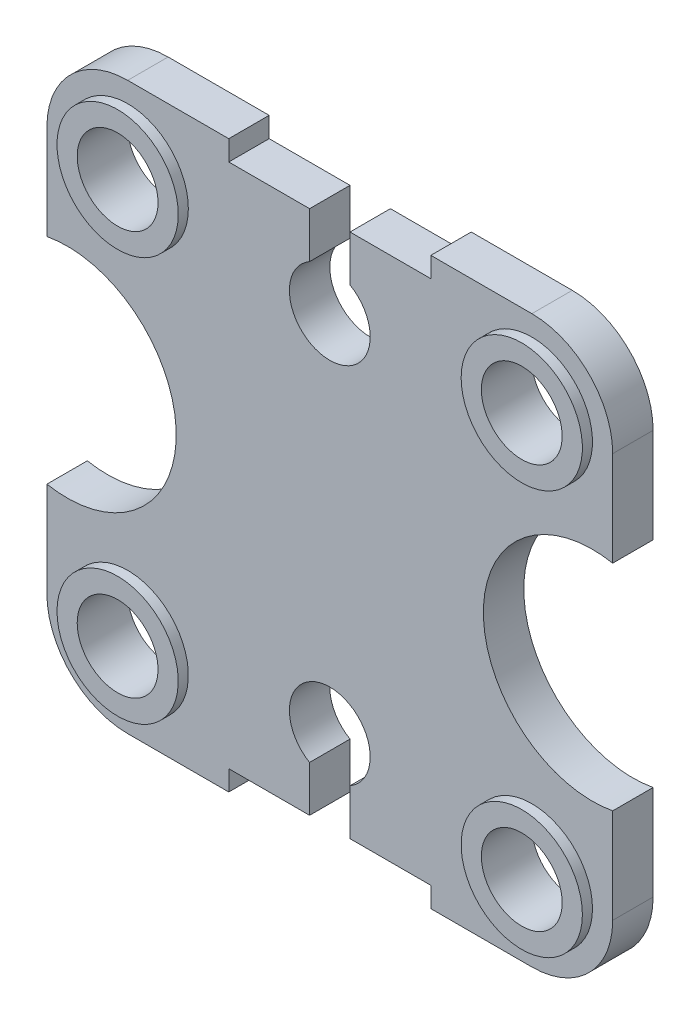
from build123d import *

# Parameters (mm, degrees)
BOSS_EXTRUDE1_DEPTH = 20
CUT_EXTRUDE1_DEPTH  = 20
SKETCH3_R           = 20
CUT_EXTRUDE2_DEPTH  = 20
SKETCH5_R           = 30
BOSS_EXTRUDE2_DEPTH = 5
CUT_EXTRUDE5_START  = 5
SKETCH7_R           = 20
CUT_EXTRUDE5_DEPTH  = 5


with BuildPart() as part:
    # Sketch1 → Boss-Extrude1 (new body)
    with BuildSketch(Plane.XY):
        with BuildLine():
            Line((-100, 140), (100, 140))
            ThreePointArc((100, 140), (128.284271247, 128.284271247), (140, 100))
            Line((140, 100), (140, 53.065996646))
            ThreePointArc((140, 53.065996646), (76, 0), (140, -53.065996646))
            Line((140, -53.065996646), (140, -100))
            ThreePointArc((140, -100), (128.284271247, -128.284271247), (100, -140))
            Line((100, -140), (-100, -140))
            ThreePointArc((-100, -140), (-128.284271247, -128.284271247), (-140, -100))
            Line((-140, -100), (-140, -53.065996646))
            ThreePointArc((-140, -53.065996646), (-76, 0), (-140, 53.065996646))
            Line((-140, 53.065996646), (-140, 100))
            ThreePointArc((-140, 100), (-128.284271247, 128.284271247), (-100, 140))
        make_face()
    extrude(amount=BOSS_EXTRUDE1_DEPTH)

    # Sketch2 → Cut-Extrude1 (cut)
    with BuildSketch(Plane.XY.offset(20)):
        with BuildLine():
            Line((-50, -130), (-10, -130))
            Line((-10, -130), (-10, -107.320508076))
            ThreePointArc((-10, -107.320508076), (0, -70), (10, -107.320508076))
            Line((10, -107.320508076), (10, -130))
            Line((10, -130), (50, -130))
            Line((50, -130), (50, -140))
            Line((50, -140), (-50, -140))
            Line((-50, -140), (-50, -130))
        make_face()
        with BuildLine():
            Line((10, 130), (50, 130))
            Line((50, 130), (50, 140))
            Line((50, 140), (-50, 140))
            Line((-50, 140), (-50, 130))
            Line((-50, 130), (-10, 130))
            Line((-10, 130), (-10, 107.320508076))
            ThreePointArc((-10, 107.320508076), (0, 70), (10, 107.320508076))
            Line((10, 107.320508076), (10, 130))
        make_face()
    extrude(amount=-CUT_EXTRUDE1_DEPTH, mode=Mode.SUBTRACT)

    # Sketch3 → Cut-Extrude2 (cut)
    with BuildSketch(Plane.XY.offset(20)):
        with Locations((100, -100)):
            Circle(SKETCH3_R)
        with Locations(Location((-100, -100, 0), (0, 0, 180))):
            Circle(SKETCH3_R)
        with Locations((-100, 100)):
            Circle(SKETCH3_R)
        with Locations(Location((100, 100, 0), (0, 0, 180))):
            Circle(SKETCH3_R)
    extrude(amount=-CUT_EXTRUDE2_DEPTH, mode=Mode.SUBTRACT)

    # Sketch5 → Boss-Extrude2 (add)
    with BuildSketch(Plane.XY.offset(20)):
        with Locations((-100, 100)):
            Circle(SKETCH5_R)
        with Locations(Location((100, 100, 0), (0, 0, 180))):
            Circle(SKETCH5_R)
        with Locations((100, -100)):
            Circle(SKETCH5_R)
        with Locations(Location((-100, -100, 0), (0, 0, 180))):
            Circle(SKETCH5_R)
    extrude(amount=BOSS_EXTRUDE2_DEPTH)

    # Sketch7 → Cut-Extrude5 (cut)
    with BuildSketch(Plane.XY.offset(20).offset(CUT_EXTRUDE5_START)):
        with Locations((-100, 100)):
            Circle(SKETCH7_R)
        with Locations(Location((100, 100, 0), (0, 0, 180))):
            Circle(SKETCH7_R)
        with Locations((100, -100)):
            Circle(SKETCH7_R)
        with Locations(Location((-100, -100, 0), (0, 0, 180))):
            Circle(SKETCH7_R)
    extrude(amount=-CUT_EXTRUDE5_DEPTH, mode=Mode.SUBTRACT)


solid = part.part
